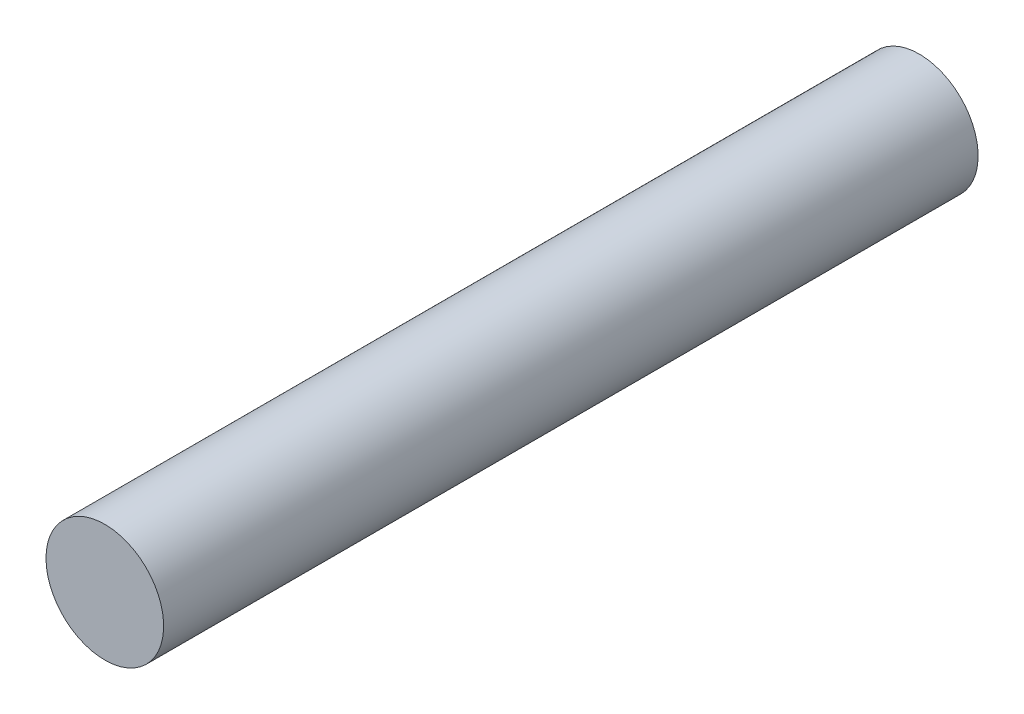
from build123d import *

# Parameters (mm, degrees)
SKETCH_1_R      = 6.5
EXTRUDE_1_DEPTH = 90


with BuildPart() as part:
    # Эскиз1 → Бобышка-Вытянуть1 (new body)
    with BuildSketch(Plane.XY):
        with Locations(Location((0, 0, 0), (0, 0, 180))):
            Circle(SKETCH_1_R)
    extrude(amount=EXTRUDE_1_DEPTH)


solid = part.part
